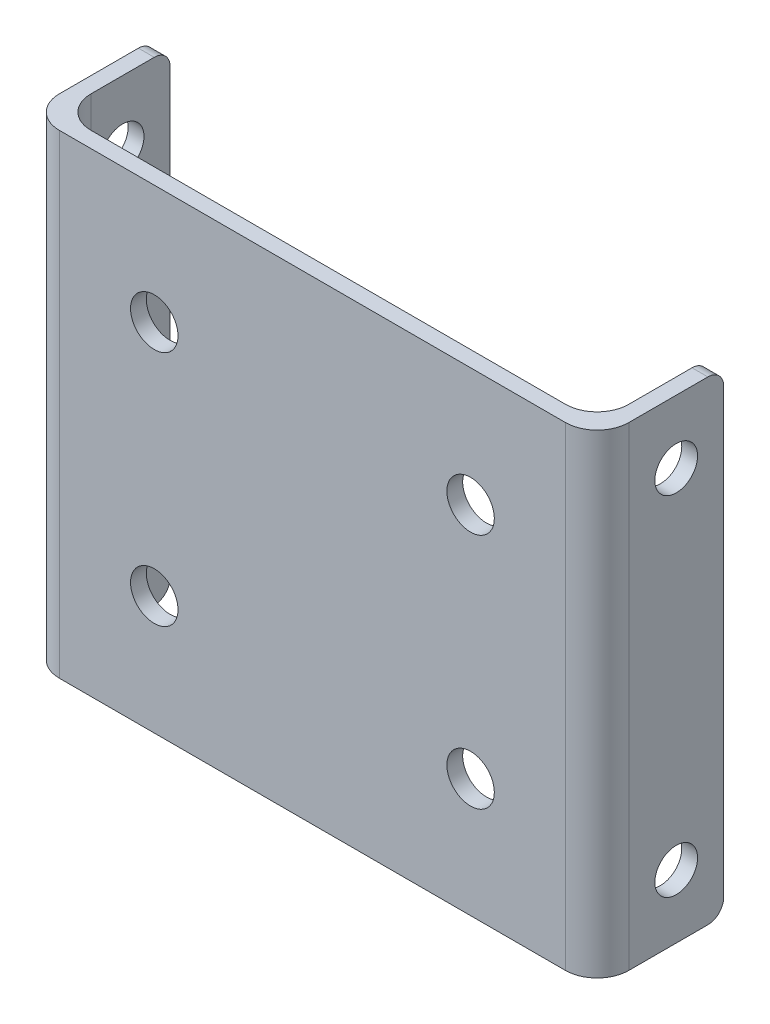
from build123d import *

# Parameters (mm, degrees)
BOSS_EXTRUDE1_DEPTH = 30
FILLET2_R           = 2
SKETCH3_R           = 1.5
CUT_EXTRUDE4_DEPTH  = 39.34383914
SKETCH4_R           = 1.35
CUT_EXTRUDE3_DEPTH  = 48.457876059
FILLET3_R           = 1


with BuildPart() as part:
    # Sketch1 → Boss-Extrude1 (new body)
    with BuildSketch(Plane(origin=(0, 0, 0), x_dir=(1, 0, 0), z_dir=(0, 1, 0))):
        Polygon((-21.5, 0.5), (12.5, 0.5), (12.5, 7.5), (13.5, 7.5), (13.5, 0.5), (13.5, -0.5), (-22.5, -0.5), (-22.5, 0.5), (-22.5, 7.5), (-21.5, 7.5), align=None)
    extrude(amount=BOSS_EXTRUDE1_DEPTH)

    # Fillet2
    fillet2_edges = [part.edges().sort_by_distance(p)[0] for p in [
        (13.5, 15, 0.5),
        (-22.5, 15, 0.5),
        (-21.5, 15, -0.5),
        (12.5, 15, -0.5),
    ]]
    fillet(fillet2_edges, radius=FILLET2_R)

    # Sketch3 → Cut-Extrude4 (cut, through all)
    with BuildSketch(Plane.XY.offset(0.5)):
        with Locations((-14.5, 22.5)):
            Circle(SKETCH3_R)
        with Locations((5.5, 22.5)):
            Circle(SKETCH3_R)
        with Locations((-14.5, 7.5)):
            Circle(SKETCH3_R)
        with Locations((5.5, 7.5)):
            Circle(SKETCH3_R)
    extrude(amount=-CUT_EXTRUDE4_DEPTH, mode=Mode.SUBTRACT)

    # Sketch4 → Cut-Extrude3 (cut, through all)
    with BuildSketch(Plane(origin=(13.5, 0, 0), x_dir=(0, 0, -1), z_dir=(1, 0, 0))):
        with Locations((4.5, 26)):
            Circle(SKETCH4_R)
        with Locations((4.5, 4)):
            Circle(SKETCH4_R)
    extrude(amount=-CUT_EXTRUDE3_DEPTH, mode=Mode.SUBTRACT)

    # Fillet3
    fillet3_edges = [part.edges().sort_by_distance(p)[0] for p in [
        (13, 30, -7.5),
        (-22, 0, -7.5),
        (13, 0, -7.5),
        (-22, 30, -7.5),
    ]]
    fillet(fillet3_edges, radius=FILLET3_R)


solid = part.part
